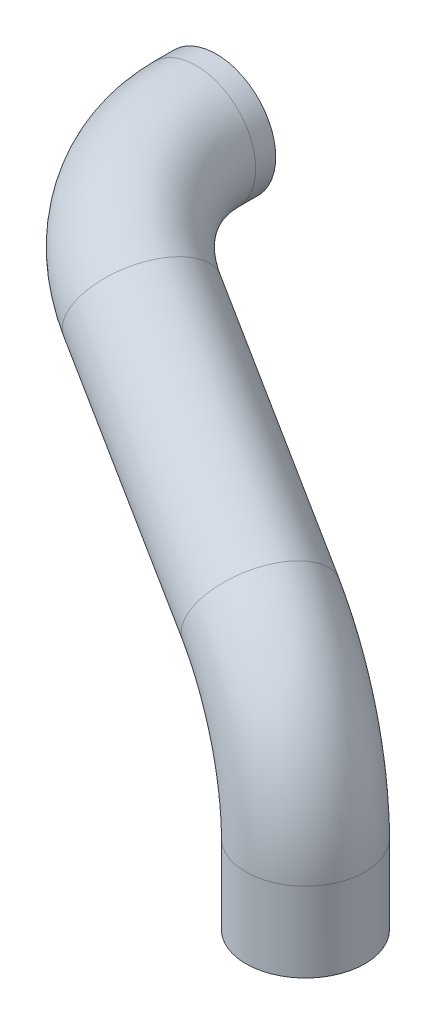
from build123d import *

# Parameters (mm, degrees)
SWEEP_1_PROFILE_R   = 10
SWEEP_1_PROFILE_R_2 = 7.5


with BuildPart() as part:
    # 扫描-薄件1: sweep along a curve in space
    with BuildLine() as sweep_1_path:
        Line((0, 0, 0), (0, 13.370069625, 0))
        ThreePointArc((0, 13.370069625, 0), (-3.799479767, 27.216391611, -1.753606046), (-13.925963802, 36.427367909, -6.427367909))
        Line((-51.074036198, 53.572632091, -23.572632091), (-13.925963802, 36.427367909, -6.427367909))
        ThreePointArc((-65, 60, -46.629930375), (-61.200520233, 58.246393954, -32.783608389), (-51.074036198, 53.572632091, -23.572632091))
        Line((-65, 60, -50), (-65, 60, -46.629930375))
    # 扫描-薄件1 profile (on start of the path) → 扫描-薄件1 (sweep)
    with BuildSketch(Plane.ZX):
        Circle(SWEEP_1_PROFILE_R)
        Circle(SWEEP_1_PROFILE_R_2, mode=Mode.SUBTRACT)
    sweep(path=sweep_1_path.line)


solid = part.part
